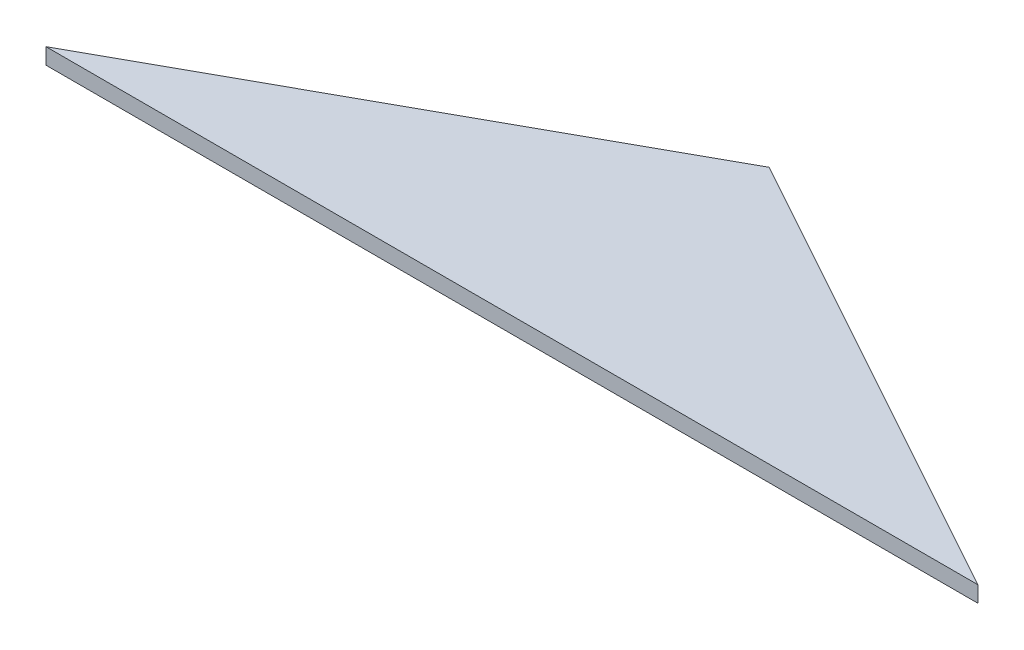
from build123d import *

# Parameters (mm, degrees)
BOSS_EXTRUDE1_DEPTH = 5


with BuildPart() as part:
    # Sketch1 → Boss-Extrude1 (new body)
    with BuildSketch(Plane(origin=(0, 0, 0), x_dir=(1, 0, 0), z_dir=(0, 1, 0))):
        Polygon((-145, 0), (145, 0), (0, 80), align=None)
    extrude(amount=BOSS_EXTRUDE1_DEPTH)


solid = part.part
